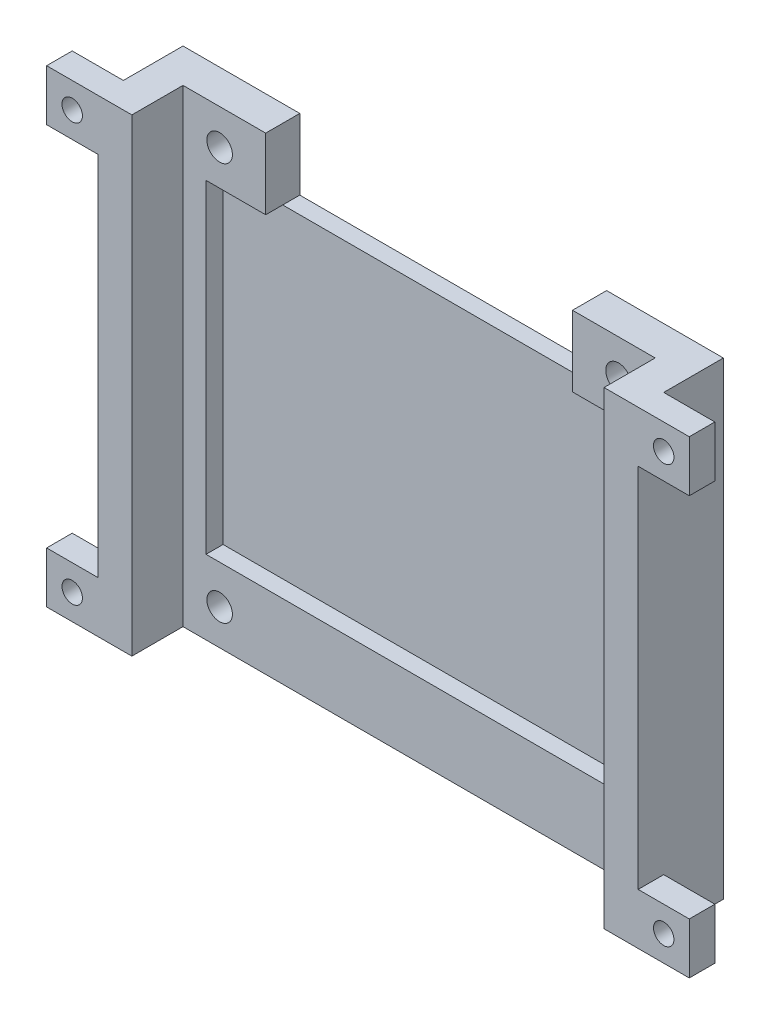
from build123d import *

# Parameters (mm, degrees)
SKETCH_1_W          = 27.7
SKETCH_1_H          = 27.5
EXTRUDE_1_DEPTH     = 2
SKETCH_1_13_W       = 2
SKETCH_1_13_H       = 27.5
EXTRUDE_2_DEPTH     = 5
SKETCH_2_R          = 0.75
SKETCH_2_W          = 18
SKETCH_2_H          = 4.15
CUT_EXTRUDE_1_DEPTH = 22.196344024
SKETCH_2_3_W        = 25
SKETCH_2_3_H        = 19
CUT_EXTRUDE_2_DEPTH = 1
EXTRUDE_START       = 5
SKETCH_1_14_W       = 3
SKETCH_1_14_H       = 3
SKETCH_1_14_R       = 0.6
EXTRUDE_3_DEPTH     = 1.5


with BuildPart() as part:
    # 草图1 → 凸台-拉伸1 (new body)
    with BuildSketch(Plane.XY):
        Rectangle(SKETCH_1_W, SKETCH_1_H)
    extrude(amount=EXTRUDE_1_DEPTH)

    # 草图1<13> → 凸台-拉伸2 (add)
    with BuildSketch(Plane.XY):
        with Locations((-14.85, 0)):
            Rectangle(SKETCH_1_13_W, SKETCH_1_13_H)
        with Locations((14.85, 0)):
            Rectangle(SKETCH_1_13_W, SKETCH_1_13_H)
    extrude(amount=EXTRUDE_2_DEPTH)

    # 草图2 → 切除-拉伸1 (cut, through all)
    with BuildSketch(Plane.XY.offset(2)):
        with Locations((-11.7, 11.675)):
            Circle(SKETCH_2_R)
        with Locations((11.7, 11.675)):
            Circle(SKETCH_2_R)
        with Locations((-11.7, -11.675)):
            Circle(SKETCH_2_R)
        with Locations((11.7, -11.675)):
            Circle(SKETCH_2_R)
        with Locations((0, 11.675)):
            Rectangle(SKETCH_2_W, SKETCH_2_H)
    extrude(amount=-CUT_EXTRUDE_1_DEPTH, mode=Mode.SUBTRACT)

    # 草图2<3> → 切除-拉伸2 (cut)
    with BuildSketch(Plane.XY.offset(2)):
        with Locations((0, 0.1)):
            Rectangle(SKETCH_2_3_W, SKETCH_2_3_H)
    extrude(amount=-CUT_EXTRUDE_2_DEPTH, mode=Mode.SUBTRACT)

    # 草图1<14> → 凸台-拉伸3 (add)
    # profile 1 of 4: a face of its own
    with BuildSketch(Plane.XY.offset(EXTRUDE_START)):
        with Locations((-17.35, 12.25)):
            Rectangle(SKETCH_1_14_W, SKETCH_1_14_H)
        with Locations((-17.35, 12.25)):
            Circle(SKETCH_1_14_R, mode=Mode.SUBTRACT)
    # profile 2 of 4: a face of its own
    with BuildSketch(Plane.XY.offset(EXTRUDE_START)):
        with Locations((-17.35, -12.25)):
            Rectangle(SKETCH_1_14_W, SKETCH_1_14_H)
        with Locations((-17.35, -12.25)):
            Circle(SKETCH_1_14_R, mode=Mode.SUBTRACT)
    # profile 3 of 4: a face of its own
    with BuildSketch(Plane.XY.offset(EXTRUDE_START)):
        with Locations((17.35, -12.25)):
            Rectangle(SKETCH_1_14_W, SKETCH_1_14_H)
        with Locations((17.35, -12.25)):
            Circle(SKETCH_1_14_R, mode=Mode.SUBTRACT)
    # profile 4 of 4: a face of its own
    with BuildSketch(Plane.XY.offset(EXTRUDE_START)):
        with Locations((17.35, 12.25)):
            Rectangle(SKETCH_1_14_W, SKETCH_1_14_H)
        with Locations((17.35, 12.25)):
            Circle(SKETCH_1_14_R, mode=Mode.SUBTRACT)
    extrude(amount=-EXTRUDE_3_DEPTH)


solid = part.part
